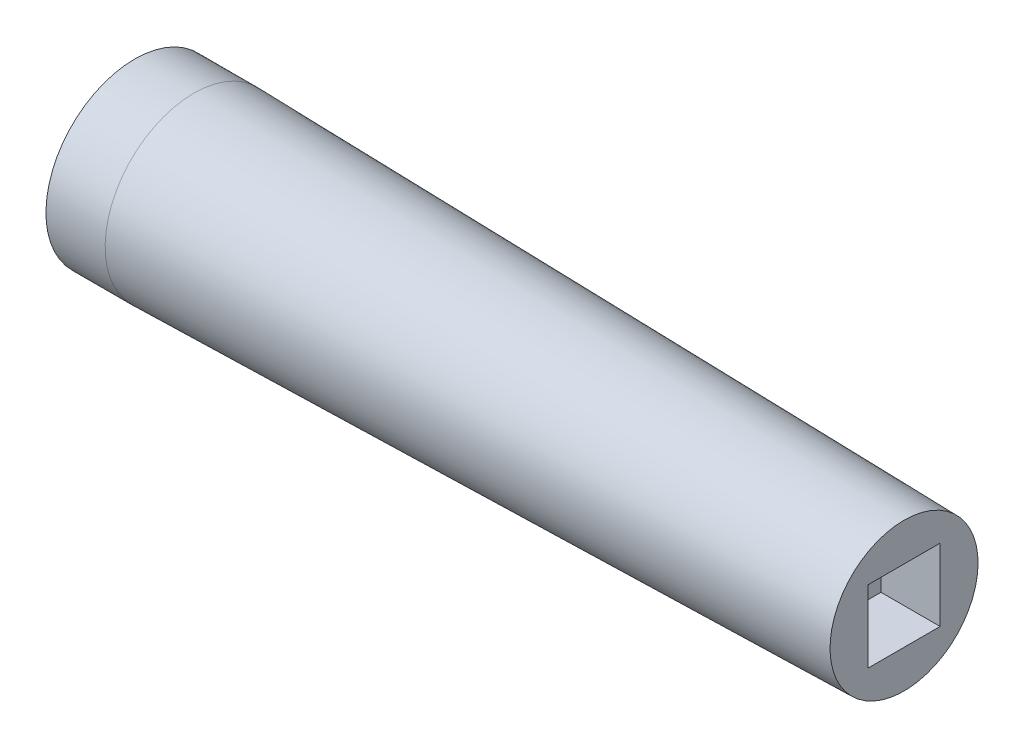
from build123d import *

# Parameters (mm, degrees)
SKETCH2_W          = 15.49
SKETCH2_H          = 15.49
CUT_EXTRUDE1_DEPTH = 12.7


with BuildPart() as part:
    # Sketch1 → Revolve1 (revolve)
    with BuildSketch(Plane.XY):
        Polygon((82.55, 0), (-82.55, 0), (-82.55, 19.05), (-69.85, 19.05), (82.55, 15.88), align=None)
    revolve(axis=Axis((82.55, 0, 0), (-1, 0, 0)))

    # Sketch2 → Cut-Extrude1 (cut)
    with BuildSketch(Plane(origin=(82.55, 0, 0), x_dir=(0, 0, -1), z_dir=(1, 0, 0))):
        Rectangle(SKETCH2_W, SKETCH2_H)
    extrude(amount=-CUT_EXTRUDE1_DEPTH, mode=Mode.SUBTRACT)


solid = part.part
